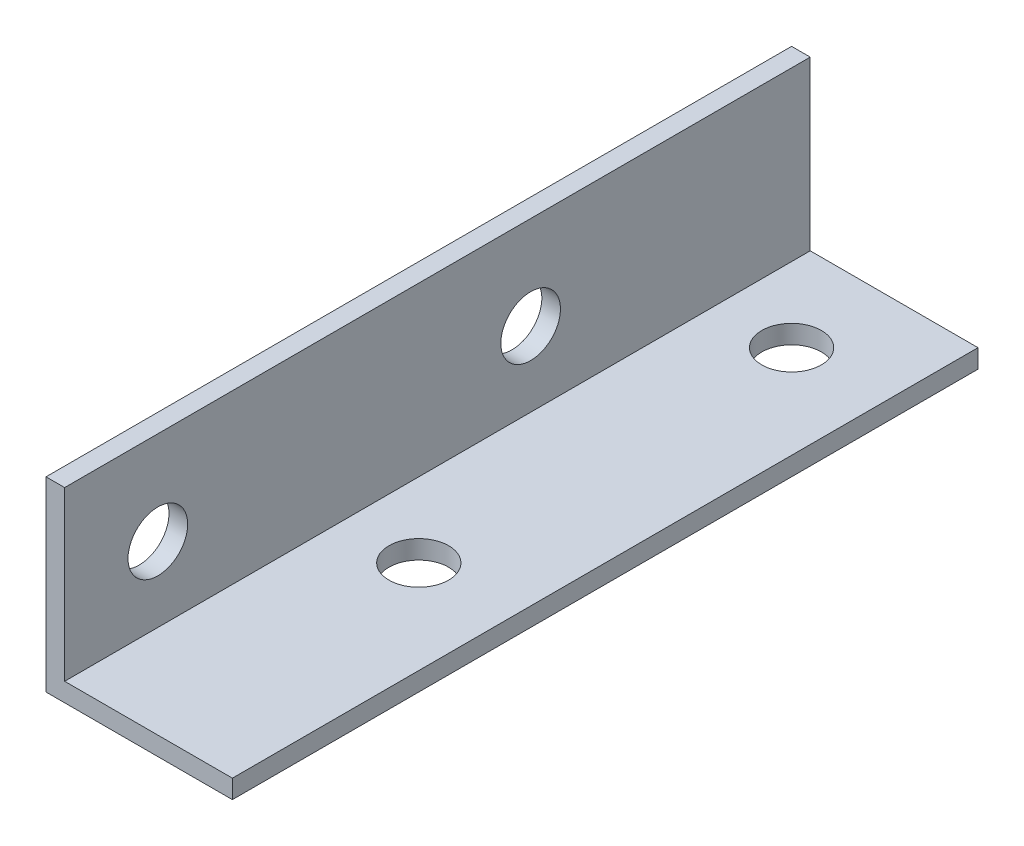
from build123d import *

# Parameters (mm, degrees)
EXTRUDE_1_DEPTH          = 40
CUT_EXTRUDE_1_DEPTH      = 42.533119315
CUT_EXTRUDE_1_DEPTH_BACK = 42.533119315
SKETCH_2_R               = 1.6
SKETCH_3_R               = 1.6
CUT_EXTRUDE_2_DEPTH      = 42.533119315


with BuildPart() as part:
    # ｽｹｯﾁ1 → ﾎﾞｽ - 押し出し1 (new body)
    with BuildSketch(Plane.XY):
        Polygon((-4, 5), (-4, -4), (5, -4), (5, -5), (-5, -5), (-5, 5), align=None)
    extrude(amount=EXTRUDE_1_DEPTH)

    # ｽｹｯﾁ2 → ｶｯﾄ - 押し出し1 (cut, two sides: drawn at the far end of the back side and taken through both)
    with BuildSketch(Plane.XZ.offset(5).offset(-CUT_EXTRUDE_1_DEPTH_BACK)):
        with Locations(Location((0, 5, 0), (0, 0, 270))):
            Circle(SKETCH_2_R)
        with Locations(Location((0, 25, 0), (0, 0, 270))):
            Circle(SKETCH_2_R)
    extrude(amount=CUT_EXTRUDE_1_DEPTH + CUT_EXTRUDE_1_DEPTH_BACK, mode=Mode.SUBTRACT)

    # ｽｹｯﾁ3 → ｶｯﾄ - 押し出し2 (cut, through all)
    with BuildSketch(Plane.ZY.offset(5)):
        with Locations((15, 0)):
            Circle(SKETCH_3_R)
        with Locations((35, 0)):
            Circle(SKETCH_3_R)
    extrude(amount=-CUT_EXTRUDE_2_DEPTH, mode=Mode.SUBTRACT)


solid = part.part
